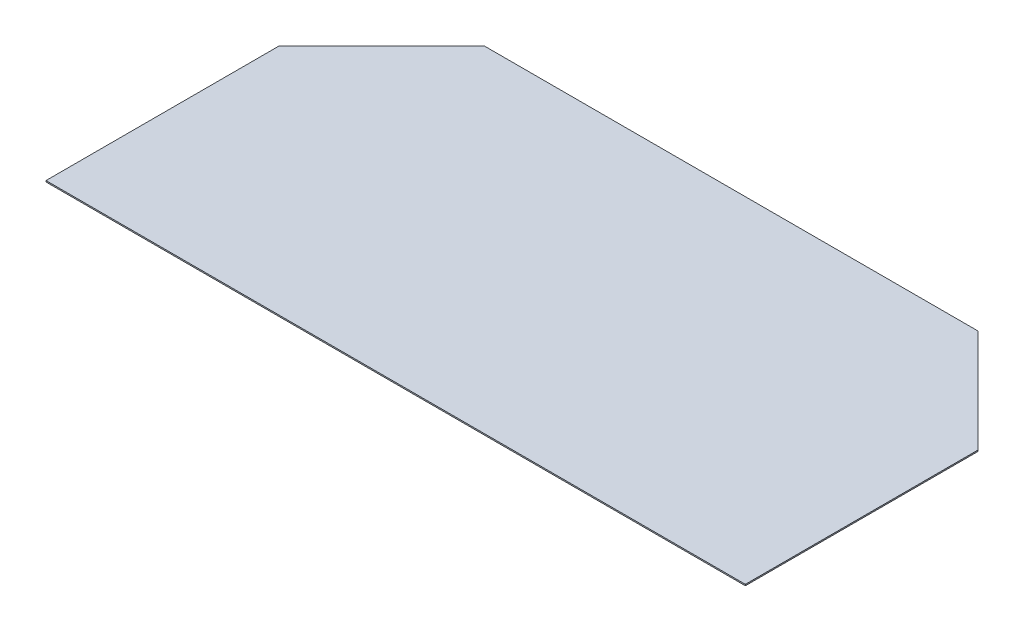
from build123d import *

# Parameters (mm, degrees)
BOSS_EXTRUDE1_DEPTH = 0.23


with BuildPart() as part:
    # Sketch1 → Boss-Extrude1 (new body)
    with BuildSketch(Plane(origin=(0, 0, 0), x_dir=(1, 0, 0), z_dir=(0, 1, 0))):
        Polygon((0, 0), (125, 0), (125, 41.58), (106.58, 60), (18.42, 60), (0, 41.58), align=None)
    extrude(amount=BOSS_EXTRUDE1_DEPTH)


solid = part.part
